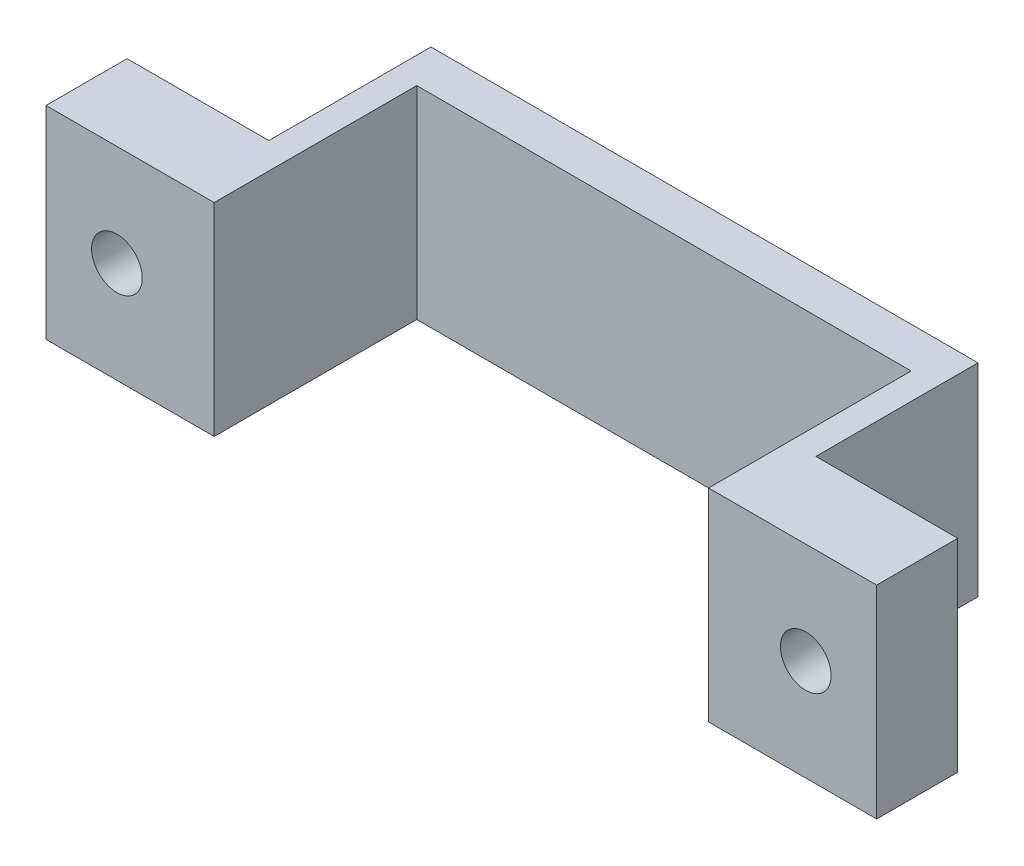
from build123d import *

# Parameters (mm, degrees)
EXTRUDE_1_DEPTH     = 10
SKETCH_3_R          = 1.25
CUT_EXTRUDE_2_DEPTH = 4


with BuildPart() as part:
    # Эскиз1 → Бобышка-Вытянуть1 (new body)
    with BuildSketch(Plane(origin=(0, 0, 0), x_dir=(1, 0, 0), z_dir=(0, 1, 0))):
        Polygon((-13.5, 2), (13.5, 2), (13.5, -6), (20.5, -6), (20.5, -10), (12.2, -10), (12.2, 0), (-12.2, 0), (-12.2, -10), (-20.5, -10), (-20.5, -6), (-13.5, -6), align=None)
    extrude(amount=EXTRUDE_1_DEPTH)

    # Эскиз3 → Вырез-Вытянуть2 (cut)
    with BuildSketch(Plane(origin=(0, 0, 6), x_dir=(-1, 0, 0), z_dir=(0, 0, -1))):
        with Locations((17, 5)):
            Circle(SKETCH_3_R)
    cut_extrude_2 = extrude(amount=-CUT_EXTRUDE_2_DEPTH, mode=Mode.SUBTRACT)

    # Зеркальное отражение1: Вырез-Вытянуть2 across plane
    add(cut_extrude_2.mirror(Plane.ZY), mode=Mode.SUBTRACT)


solid = part.part
